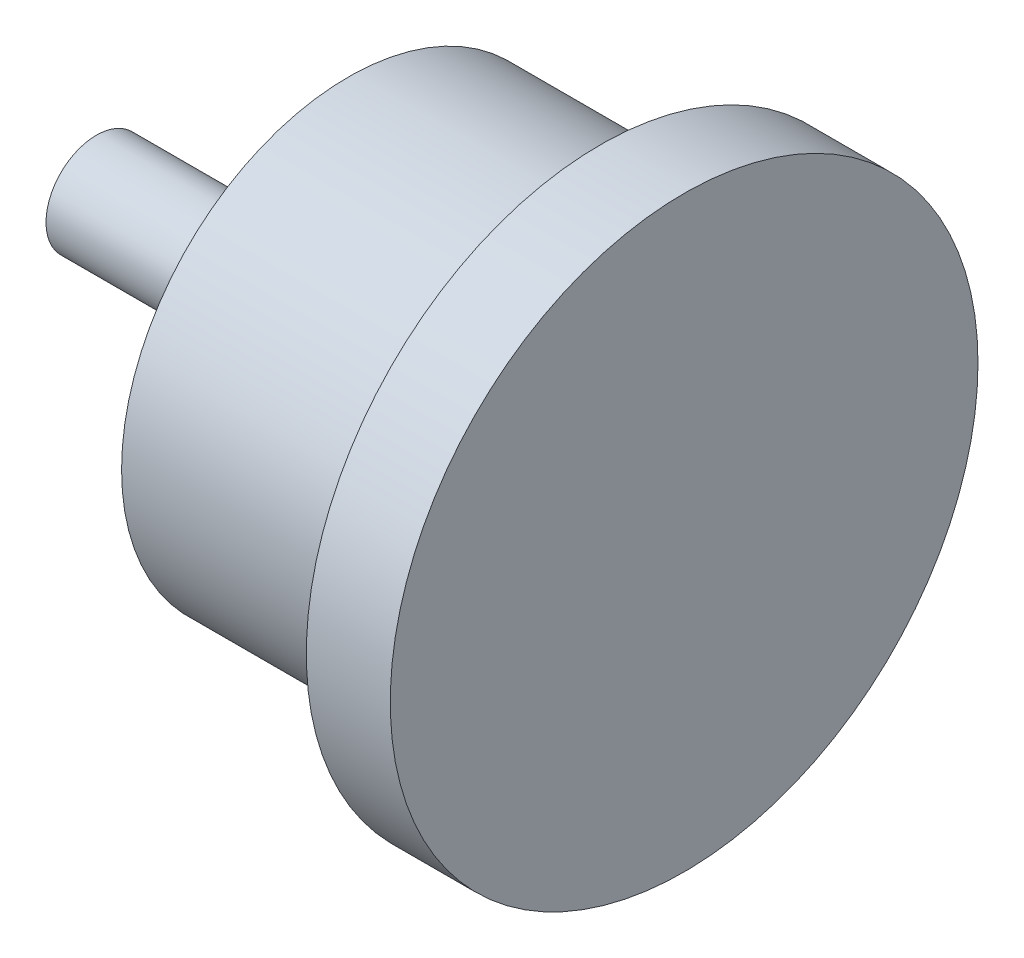
from build123d import *

# Parameters (mm, degrees)
SKETCH1_R           = 17.5
BOSS_EXTRUDE1_DEPTH = 5
SKETCH2_R           = 13.5
BOSS_EXTRUDE2_DEPTH = 15
SKETCH3_R           = 3
BOSS_EXTRUDE3_DEPTH = 15


with BuildPart() as part:
    # Sketch1 → Boss-Extrude1 (new body)
    with BuildSketch(Plane(origin=(0, 0, 0), x_dir=(0, 0, -1), z_dir=(1, 0, 0))):
        Circle(SKETCH1_R)
    extrude(amount=BOSS_EXTRUDE1_DEPTH)

    # Sketch2 → Boss-Extrude2 (add)
    with BuildSketch(Plane.ZY):
        Circle(SKETCH2_R)
    extrude(amount=BOSS_EXTRUDE2_DEPTH)

    # Sketch3 → Boss-Extrude3 (add)
    with BuildSketch(Plane.ZY.offset(15)):
        Circle(SKETCH3_R)
    extrude(amount=BOSS_EXTRUDE3_DEPTH)


solid = part.part
